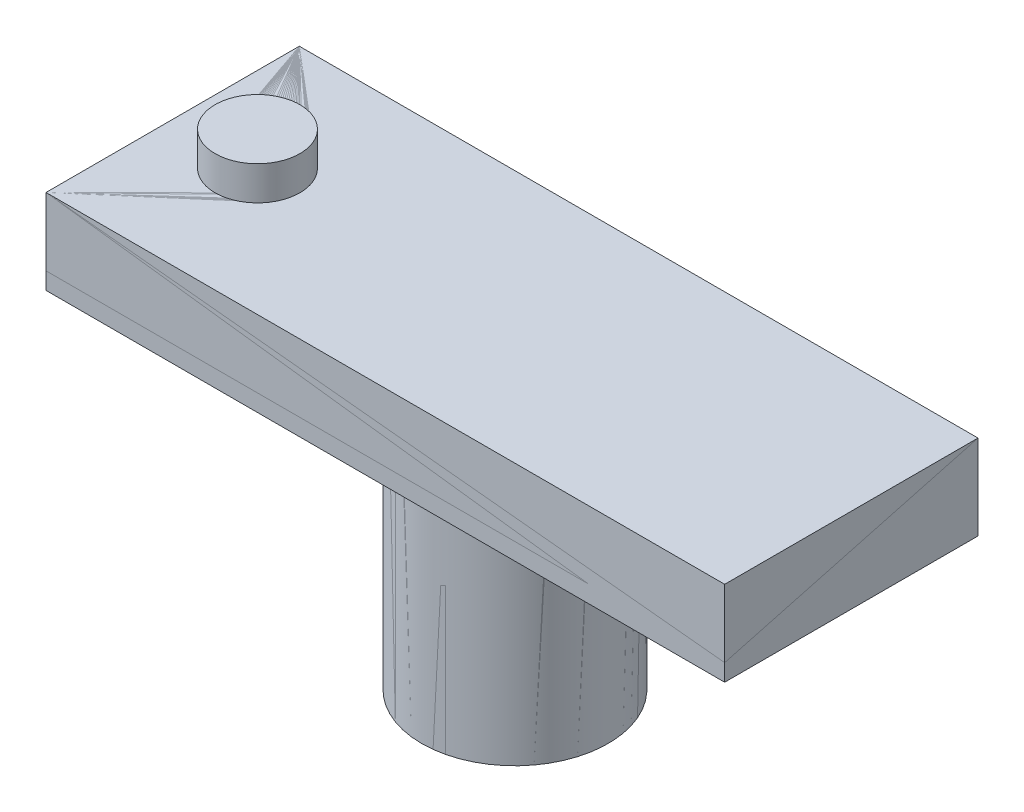
from build123d import *

# Parameters (mm, degrees)
SKETCH1_R                = 5.5
SKETCH1_R_2              = 4
BOSS_EXTRUDE1_DEPTH      = 15
BOSS_EXTRUDE2_DEPTH      = 4
BOSS_EXTRUDE2_DEPTH_BACK = 1
SKETCH3_W                = 40
SKETCH3_H                = 14.930774712
CUT_EXTRUDE1_DEPTH       = 9
CUT_EXTRUDE1_DEPTH_BACK  = 10
SKETCH3_4_R              = 2.5
CUT_EXTRUDE6_DEPTH       = 14
CUT_EXTRUDE6_DEPTH_BACK  = 12
SKETCH3_6_R              = 2.5
SKETCH1_2_R              = 5.5
SKETCH1_2_R_2            = 4
BOSS_EXTRUDE3_DEPTH      = 15
SKETCH3_15_W             = 40
SKETCH3_15_H             = 14.930774712
BOSS_EXTRUDE4_DEPTH      = 4
BOSS_EXTRUDE6_DEPTH      = 6
BOSS_EXTRUDE6_DEPTH_BACK = 3
SKETCH3_18_R             = 2.5


with BuildPart() as part:
    # Sketch1 → Boss-Extrude1 (new body)
    with BuildSketch(Plane(origin=(0, 0, 0), x_dir=(1, 0, 0), z_dir=(0, 1, 0))):
        with Locations((0.196069677, -0.023946328)):
            Circle(SKETCH1_R)
        Circle(SKETCH1_R_2, mode=Mode.SUBTRACT)
    extrude(amount=BOSS_EXTRUDE1_DEPTH)

    # Sketch3 → Boss-Extrude2 (add, two sides: drawn at the far end of the back side and taken through both)
    with BuildSketch(Plane(origin=(0, 15, 0), x_dir=(1, 0, 0), z_dir=(0, 1, 0)).offset(-BOSS_EXTRUDE2_DEPTH_BACK)):
        Rectangle(SKETCH3_W, SKETCH3_H)
    extrude(amount=BOSS_EXTRUDE2_DEPTH + BOSS_EXTRUDE2_DEPTH_BACK)

    # Sketch3<4> → Cut-Extrude1 (cut, two sides: drawn at the far end of the back side and taken through both)
    with BuildSketch(Plane(origin=(0, 15, 0), x_dir=(1, 0, 0), z_dir=(0, 1, 0)).offset(-CUT_EXTRUDE1_DEPTH_BACK)):
        with Locations((15, 0)):
            Circle(SKETCH3_4_R)
    extrude(amount=CUT_EXTRUDE1_DEPTH + CUT_EXTRUDE1_DEPTH_BACK, mode=Mode.SUBTRACT)

    # Sketch3<6> → Cut-Extrude6 (cut, two sides: drawn at the far end of the back side and taken through both)
    with BuildSketch(Plane(origin=(0, 15, 0), x_dir=(1, 0, 0), z_dir=(0, 1, 0)).offset(-CUT_EXTRUDE6_DEPTH_BACK)):
        with Locations((-15, 0)):
            Circle(SKETCH3_6_R)
    extrude(amount=CUT_EXTRUDE6_DEPTH + CUT_EXTRUDE6_DEPTH_BACK, mode=Mode.SUBTRACT)


with BuildPart() as body_2:
    # Sketch1<2> → Boss-Extrude3 (new body)
    with BuildSketch(Plane(origin=(0, 0, 0), x_dir=(1, 0, 0), z_dir=(0, 1, 0))):
        with Locations((0.196069677, -0.023946328)):
            Circle(SKETCH1_2_R)
        Circle(SKETCH1_2_R_2, mode=Mode.SUBTRACT)
    extrude(amount=BOSS_EXTRUDE3_DEPTH)

    # Sketch3<15> → Boss-Extrude4 (add)
    with BuildSketch(Plane(origin=(0, 15, 0), x_dir=(1, 0, 0), z_dir=(0, 1, 0))):
        Rectangle(SKETCH3_15_W, SKETCH3_15_H)
    extrude(amount=BOSS_EXTRUDE4_DEPTH)

    # Sketch3<18> → Boss-Extrude6 (add, two sides: drawn at the far end of the back side and taken through both)
    with BuildSketch(Plane(origin=(0, 15, 0), x_dir=(1, 0, 0), z_dir=(0, 1, 0)).offset(-BOSS_EXTRUDE6_DEPTH_BACK)):
        with Locations((-15, 0)):
            Circle(SKETCH3_18_R)
    extrude(amount=BOSS_EXTRUDE6_DEPTH + BOSS_EXTRUDE6_DEPTH_BACK)


solid = Compound([part.part, body_2.part])
